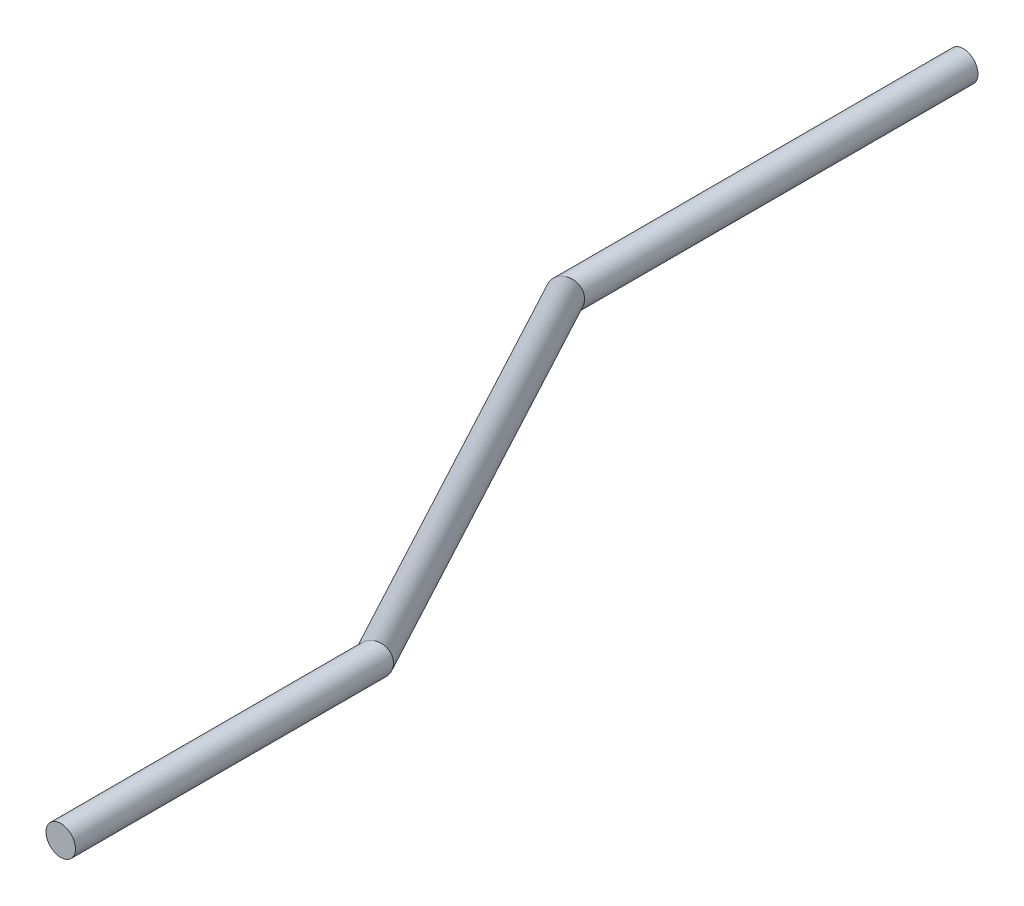
from build123d import *

# Parameters (mm, degrees)
ROUND_TPU_CORD_1_2_MM_PROFILE_R = 0.6


with BuildPart() as part:
    # Round TPU cord - 1.2 mm: sweep along a curve in space
    with BuildLine() as round_tpu_cord_1_2_mm_path:
        Line((-30, 0, -16.2), (-30, 0, 0))
        Line((-30, 0, 0), (-11.820190771, 9.234884414, 25.959933688))
        Line((-11.820190771, 9.234884414, 25.959933688), (-11.820190771, 9.234884414, 38.709933688))
    # Round TPU cord - 1.2 mm profile (on start of the path) → Round TPU cord - 1.2 mm (sweep)
    with BuildSketch(Plane(origin=(-30, 0, -16.2), x_dir=(1, 0, 0), z_dir=(0, 0, 1))):
        Circle(ROUND_TPU_CORD_1_2_MM_PROFILE_R)
    sweep(path=round_tpu_cord_1_2_mm_path.line, transition=Transition.RIGHT)


solid = part.part
